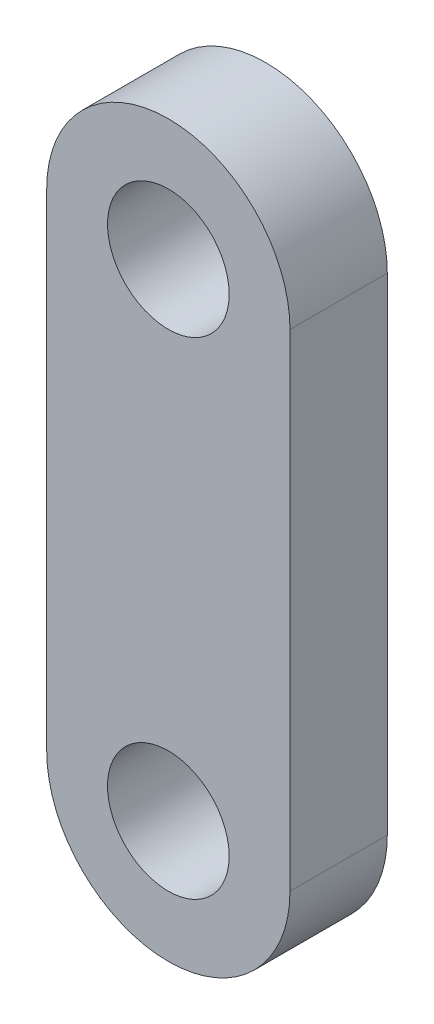
from build123d import *

# Parameters (mm, degrees)
SKETCH1_R           = 5
BOSS_EXTRUDE1_DEPTH = 8


with BuildPart() as part:
    # Sketch1 → Boss-Extrude1 (new body)
    with BuildSketch(Plane.XY):
        with BuildLine():
            Line((10, 0), (10, 40))
            ThreePointArc((10, 40), (0, 50), (-10, 40))
            Line((-10, 40), (-10, 0))
            ThreePointArc((-10, 0), (0, -10), (10, 0))
        make_face()
        with Locations((0, 40)):
            Circle(SKETCH1_R, mode=Mode.SUBTRACT)
        Circle(SKETCH1_R, mode=Mode.SUBTRACT)
    extrude(amount=-BOSS_EXTRUDE1_DEPTH)


solid = part.part
